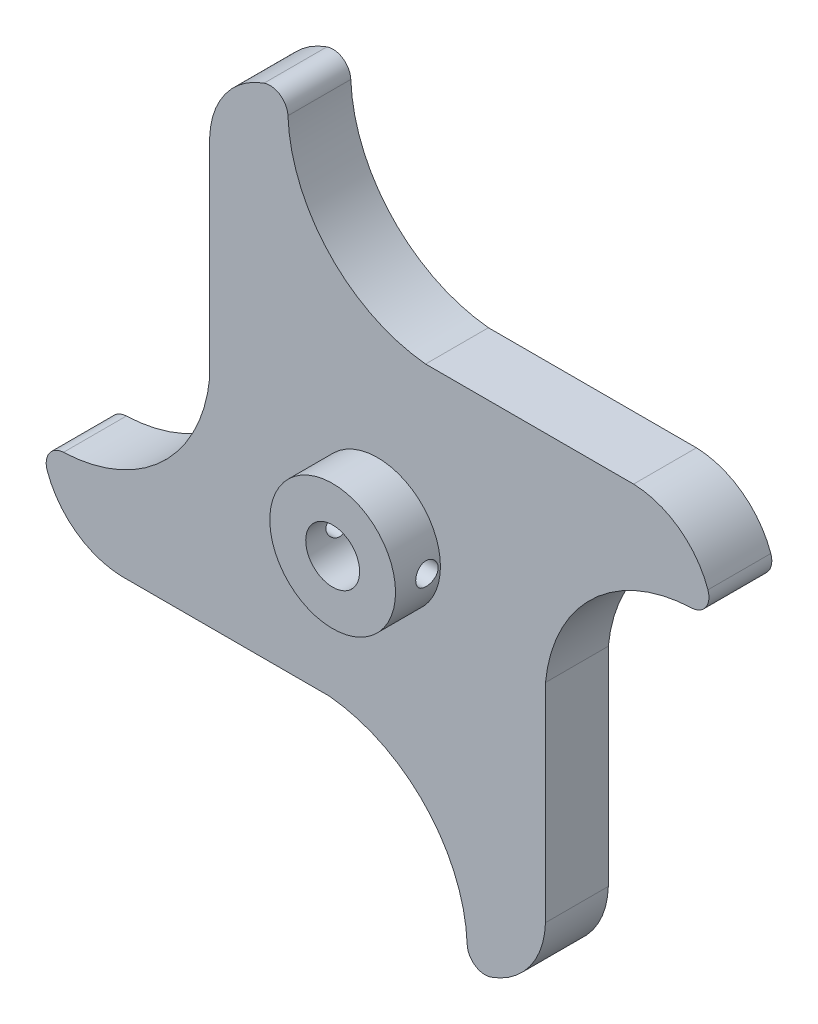
from build123d import *
from build123d.topology import SkipClean

# Parameters (mm, degrees)
SKETCH_1_R               = 3
EXTRUDE_1_DEPTH          = 7
SKETCH_5_R               = 7
EXTRUDE_2_DEPTH          = 4
EXTRUDE_START            = 7
EXTRUDE_3_DEPTH          = 7
CUT_EXTRUDE_5_DEPTH      = 8
CUT_EXTRUDE_5_DEPTH_BACK = 15
SKETCH_12_R              = 6
SKETCH_12_R_2            = 3
EXTRUDE_4_DEPTH          = 1
SKETCH_13_R              = 82.694540834
CUT_EXTRUDE_13_DEPTH     = 10
FILLET_1_R               = 2
FILLET_2_R               = 2
EXTRUDE_5_DEPTH          = 7
CUT_EXTRUDE_14_DEPTH     = 10
FILLET_3_R               = 3
FILLET_4_R               = 1
EXTRUDE_START_2          = -7
EXTRUDE_6_DEPTH          = 7
SKETCH_18_R              = 47.238796546
CUT_EXTRUDE_15_DEPTH     = 10
FILLET_5_R               = 2
SKETCH_22_R              = 7
SKETCH_22_R_2            = 6
EXTRUDE_8_DEPTH          = 1


with BuildPart() as part:
    # 草图1 → 凸台-拉伸1 (new body)
    with BuildSketch(Plane.XY):
        with BuildLine():
            ThreePointArc((32.8, 22.894540834), (36.610888994, 26.155959788), (40.879786515, 28.789634497))
            ThreePointArc((40.879786515, 28.789634497), (35.355339059, 35.355339059), (28.789634497, 40.879786515))
            ThreePointArc((28.789634497, 40.879786515), (26.155959788, 36.610888994), (22.894540834, 32.8))
            ThreePointArc((22.894540834, 32.8), (0, 23.316770682), (-22.894540834, 32.8))
            ThreePointArc((-22.894540834, 32.8), (-26.155959788, 36.610888994), (-28.789634497, 40.879786515))
            ThreePointArc((-28.789634497, 40.879786515), (-35.355339059, 35.355339059), (-40.879786515, 28.789634497))
            ThreePointArc((-40.879786515, 28.789634497), (-36.610888994, 26.155959788), (-32.8, 22.894540834))
            ThreePointArc((-32.8, 22.894540834), (-23.316770682, 0), (-32.8, -22.894540834))
            ThreePointArc((-32.8, -22.894540834), (-36.610888994, -26.155959788), (-40.879786515, -28.789634497))
            ThreePointArc((-40.879786515, -28.789634497), (-35.355339059, -35.355339059), (-28.789634497, -40.879786515))
            ThreePointArc((-28.789634497, -40.879786515), (-26.155959788, -36.610888994), (-22.894540834, -32.8))
            ThreePointArc((-22.894540834, -32.8), (0, -23.316770682), (22.894540834, -32.8))
            ThreePointArc((22.894540834, -32.8), (26.155959788, -36.610888994), (28.789634497, -40.879786515))
            ThreePointArc((28.789634497, -40.879786515), (35.355339059, -35.355339059), (40.879786515, -28.789634497))
            ThreePointArc((40.879786515, -28.789634497), (36.610888994, -26.155959788), (32.8, -22.894540834))
            ThreePointArc((32.8, -22.894540834), (23.316770682, 0), (32.8, 22.894540834))
        make_face()
        Circle(SKETCH_1_R, mode=Mode.SUBTRACT)
    extrude(amount=EXTRUDE_1_DEPTH)

    # 草图5 → 凸台-拉伸2 (add)
    with BuildSketch(Plane.XY.offset(7)):
        Circle(SKETCH_5_R)
        with BuildLine():
            Line((-1.658312395, 2.5), (1.658312395, 2.5))
            ThreePointArc((1.658312395, 2.5), (0, -3), (-1.658312395, 2.5))
        make_face(mode=Mode.SUBTRACT)
    extrude(amount=EXTRUDE_2_DEPTH)

    # 草图10 → 凸台-拉伸3 (add)
    with BuildSketch(Plane(origin=(0, 0, 7), x_dir=(-1, 0, 0), z_dir=(0, 0, -1)).offset(EXTRUDE_START)):
        with BuildLine():
            Line((-1.658312395, 2.5), (1.658312395, 2.5))
            ThreePointArc((1.658312395, 2.5), (0, 3), (-1.658312395, 2.5))
        make_face()
    extrude(amount=-EXTRUDE_3_DEPTH)

    # 草图11 → 切除-拉伸5 (cut, two sides: drawn at the far end of the back side and taken through both)
    with BuildSketch(Plane(origin=(0, 0, 0), x_dir=(0, 0, -1), z_dir=(1, 0, 0)).offset(-CUT_EXTRUDE_5_DEPTH_BACK)):
        with BuildLine():
            ThreePointArc((-9.75, 0), (-8.5, -1.25), (-7.25, 0))
            Line((-7.25, 0), (-9.75, 0))
        make_face()
        with BuildLine():
            Line((-9.75, 0), (-7.25, 0))
            ThreePointArc((-7.25, 0), (-8.5, 1.25), (-9.75, 0))
        make_face()
    extrude(amount=CUT_EXTRUDE_5_DEPTH + CUT_EXTRUDE_5_DEPTH_BACK, mode=Mode.SUBTRACT)

    # 草图12 → 凸台-拉伸4 (add)
    with BuildSketch(Plane.XY.offset(11)):
        Circle(SKETCH_12_R)
        with Locations(Location((0, 0, 0), (0, 0, 123.557309762))):
            Circle(SKETCH_12_R_2, mode=Mode.SUBTRACT)
    extrude(amount=EXTRUDE_4_DEPTH)

    # 草图13 → 切除-拉伸13 (cut)
    with BuildSketch(Plane(origin=(0, 0, 0), x_dir=(-1, 0, 0), z_dir=(0, 0, -1))):
        Circle(SKETCH_13_R)
        with BuildLine():
            ThreePointArc((-25.243635923, 31.028355505), (0, 18.694540834), (25.243635923, 31.028355505))
            ThreePointArc((25.243635923, 31.028355505), (28.284271247, 28.284271247), (31.028355505, 25.243635923))
            ThreePointArc((31.028355505, 25.243635923), (18.694540834, 0), (31.028355505, -25.243635923))
            ThreePointArc((31.028355505, -25.243635923), (28.284271247, -28.284271247), (25.243635923, -31.028355505))
            ThreePointArc((25.243635923, -31.028355505), (0, -18.694540834), (-25.243635923, -31.028355505))
            ThreePointArc((-25.243635923, -31.028355505), (-28.284271247, -28.284271247), (-31.028355505, -25.243635923))
            ThreePointArc((-31.028355505, -25.243635923), (-18.694540834, 0), (-31.028355505, 25.243635923))
            ThreePointArc((-31.028355505, 25.243635923), (-28.284271247, 28.284271247), (-25.243635923, 31.028355505))
        make_face(mode=Mode.SUBTRACT)
    extrude(amount=-CUT_EXTRUDE_13_DEPTH, mode=Mode.SUBTRACT)

    # 圆角1
    fillet_1_edges = [part.edges().sort_by_distance(p)[0] for p in [
        (25.243635923, 31.028355505, 3.5),
        (-31.028355505, 25.243635923, 3.5),
        (-31.028355505, -25.243635923, 3.5),
        (31.028355505, -25.243635923, 3.5),
    ]]
    fillet(fillet_1_edges, radius=FILLET_1_R)

    # 圆角2
    fillet_2_edges = [part.edges().sort_by_distance(p)[0] for p in [
        (-25.243635923, 31.028355505, 3.5),
        (-25.243635923, -31.028355505, 3.5),
        (25.243635923, -31.028355505, 3.5),
        (31.028355505, 25.243635923, 3.5),
    ]]
    fillet(fillet_2_edges, radius=FILLET_2_R)

    # 草图14 → 凸台-拉伸5 (add)
    # profile 1 of 5: a face of its own
    with SkipClean():  # the faces are left unmerged after this step: merging them gives an invalid solid
        with BuildSketch(Plane(origin=(0, 0, 0), x_dir=(-1, 0, 0), z_dir=(0, 0, -1))):
            with BuildLine():
                ThreePointArc((18.694540834, 24.723130726), (9.821274778, 20.238957409), (0, 18.694540834))
                Line((0, 18.694540834), (-24.723130726, 18.694540834))
                ThreePointArc((-24.723130726, 18.694540834), (-20.238957409, 9.821274778), (-18.694540834, 0))
                Line((-18.694540834, 0), (-18.694540834, -24.723130726))
                ThreePointArc((-18.694540834, -24.723130726), (-9.821274778, -20.238957409), (0, -18.694540834))
                Line((0, -18.694540834), (24.723130726, -18.694540834))
                ThreePointArc((24.723130726, -18.694540834), (20.238957409, -9.821274778), (18.694540834, 0))
                Line((18.694540834, 0), (18.694540834, 24.723130726))
            make_face()
            with BuildLine():
                Line((-1.658312395, 2.5), (1.658312395, 2.5))
                ThreePointArc((1.658312395, 2.5), (0, -3), (-1.658312395, 2.5))
            make_face(mode=Mode.SUBTRACT)
        # profile 2 of 5: a face of its own
        with BuildSketch(Plane(origin=(0, 0, 0), x_dir=(-1, 0, 0), z_dir=(0, 0, -1))):
            with BuildLine():
                ThreePointArc((-18.694540834, 0), (-20.238957409, 9.821274778), (-24.723130726, 18.694540834))
                Line((-24.723130726, 18.694540834), (-34.095635208, 18.694540834))
                Line((-34.095635208, 18.694540834), (-34.095635208, 16.908162968))
                Line((-34.095635208, 16.908162968), (-34.095635208, 13.801737807))
                ThreePointArc((-34.095635208, 13.801737807), (-23.536654529, 10.090539986), (-18.694540834, 0))
            make_face()
        # profile 3 of 5: a face of its own
        with BuildSketch(Plane(origin=(0, 0, 0), x_dir=(-1, 0, 0), z_dir=(0, 0, -1))):
            with BuildLine():
                ThreePointArc((13.801737807, 34.095635208), (10.090539986, 23.536654529), (0, 18.694540834))
                ThreePointArc((0, 18.694540834), (9.821274778, 20.238957409), (18.694540834, 24.723130726))
                Line((18.694540834, 24.723130726), (18.694540834, 34.095635208))
                Line((18.694540834, 34.095635208), (16.908162968, 34.095635208))
                Line((16.908162968, 34.095635208), (13.801737807, 34.095635208))
            make_face()
        # profile 4 of 5: a face of its own
        with BuildSketch(Plane(origin=(0, 0, 0), x_dir=(-1, 0, 0), z_dir=(0, 0, -1))):
            with BuildLine():
                ThreePointArc((34.095635208, -13.801737807), (23.536654529, -10.090539986), (18.694540834, 0))
                ThreePointArc((18.694540834, 0), (20.238957409, -9.821274778), (24.723130726, -18.694540834))
                Line((24.723130726, -18.694540834), (34.095635208, -18.694540834))
                Line((34.095635208, -18.694540834), (34.095635208, -16.908162968))
                Line((34.095635208, -16.908162968), (34.095635208, -13.801737807))
            make_face()
        # profile 5 of 5: a face of its own
        with BuildSketch(Plane(origin=(0, 0, 0), x_dir=(-1, 0, 0), z_dir=(0, 0, -1))):
            with BuildLine():
                ThreePointArc((0, -18.694540834), (-9.821274778, -20.238957409), (-18.694540834, -24.723130726))
                Line((-18.694540834, -24.723130726), (-18.694540834, -34.095635208))
                Line((-18.694540834, -34.095635208), (-16.908162968, -34.095635208))
                Line((-16.908162968, -34.095635208), (-13.801737807, -34.095635208))
                ThreePointArc((-13.801737807, -34.095635208), (-10.090539986, -23.536654529), (0, -18.694540834))
            make_face()
        extrude(amount=-EXTRUDE_5_DEPTH)

    # 草图15 → 切除-拉伸14 (cut)
    with SkipClean():  # the faces are left unmerged after this step: merging them gives an invalid solid
        with BuildSketch(Plane(origin=(0, 0, 0), x_dir=(-1, 0, 0), z_dir=(0, 0, -1))):
            with BuildLine():
                Line((-24.723130726, 18.694540834), (-33.334723843, 25.692106251))
                Line((-33.334723843, 25.692106251), (-12.530174443, 42.497606237))
                Line((-12.530174443, 42.497606237), (0, 18.694540834))
                ThreePointArc((0, 18.694540834), (-13.155803158, 21.523924741), (-23.985180208, 29.51173813))
                ThreePointArc((-23.985180208, 29.51173813), (-25.372019669, 30.184661343), (-26.825530496, 29.671382064))
                ThreePointArc((-26.825530496, 29.671382064), (-28.284271247, 28.284271247), (-29.671382064, 26.825530496))
                ThreePointArc((-29.671382064, 26.825530496), (-30.184661343, 25.372019669), (-29.51173813, 23.985180208))
                ThreePointArc((-29.51173813, 23.985180208), (-26.969497889, 21.473759272), (-24.723130726, 18.694540834))
            make_face()
            with BuildLine():
                Line((-24.723130726, 18.694540834), (0, 18.694540834))
                ThreePointArc((0, 18.694540834), (-13.155803158, 21.523924741), (-23.985180208, 29.51173813))
                ThreePointArc((-23.985180208, 29.51173813), (-25.372019669, 30.184661343), (-26.825530496, 29.671382064))
                ThreePointArc((-26.825530496, 29.671382064), (-28.284271247, 28.284271247), (-29.671382064, 26.825530496))
                ThreePointArc((-29.671382064, 26.825530496), (-30.184661343, 25.372019669), (-29.51173813, 23.985180208))
                ThreePointArc((-29.51173813, 23.985180208), (-26.969497889, 21.473759272), (-24.723130726, 18.694540834))
            make_face()
            with BuildLine():
                Line((18.694540834, 0), (18.694540834, 24.723130726))
                ThreePointArc((18.694540834, 24.723130726), (21.473759272, 26.969497889), (23.985180208, 29.51173813))
                ThreePointArc((23.985180208, 29.51173813), (25.372019669, 30.184661343), (26.825530496, 29.671382064))
                ThreePointArc((26.825530496, 29.671382064), (28.284271247, 28.284271247), (29.671382064, 26.825530496))
                ThreePointArc((29.671382064, 26.825530496), (30.184661343, 25.372019669), (29.51173813, 23.985180208))
                ThreePointArc((29.51173813, 23.985180208), (21.523924741, 13.155803158), (18.694540834, 0))
            make_face()
            with BuildLine():
                Line((18.694540834, 24.723130726), (25.692106251, 33.334723843))
                Line((25.692106251, 33.334723843), (42.497606237, 12.530174443))
                Line((42.497606237, 12.530174443), (18.694540834, 0))
                ThreePointArc((18.694540834, 0), (21.523924741, 13.155803158), (29.51173813, 23.985180208))
                ThreePointArc((29.51173813, 23.985180208), (30.184661343, 25.372019669), (29.671382064, 26.825530496))
                ThreePointArc((29.671382064, 26.825530496), (28.284271247, 28.284271247), (26.825530496, 29.671382064))
                ThreePointArc((26.825530496, 29.671382064), (25.372019669, 30.184661343), (23.985180208, 29.51173813))
                ThreePointArc((23.985180208, 29.51173813), (21.473759272, 26.969497889), (18.694540834, 24.723130726))
            make_face()
            with BuildLine():
                ThreePointArc((29.51173813, -23.985180208), (26.969497889, -21.473759272), (24.723130726, -18.694540834))
                Line((24.723130726, -18.694540834), (0.927061706, -18.707972456))
                ThreePointArc((0.927061706, -18.707972456), (13.577013202, -21.717572178), (23.985180208, -29.51173813))
                ThreePointArc((23.985180208, -29.51173813), (25.372019669, -30.184661343), (26.825530496, -29.671382064))
                ThreePointArc((26.825530496, -29.671382064), (28.284271247, -28.284271247), (29.671382064, -26.825530496))
                ThreePointArc((29.671382064, -26.825530496), (30.184661343, -25.372019669), (29.51173813, -23.985180208))
            make_face()
            with BuildLine():
                Line((24.723130726, -18.694540834), (33.334723843, -25.692106251))
                Line((33.334723843, -25.692106251), (12.530174443, -42.497606237))
                Line((12.530174443, -42.497606237), (0, -18.694540834))
                ThreePointArc((0, -18.694540834), (13.155803158, -21.523924741), (23.985180208, -29.51173813))
                ThreePointArc((23.985180208, -29.51173813), (25.372019669, -30.184661343), (26.825530496, -29.671382064))
                ThreePointArc((26.825530496, -29.671382064), (28.284271247, -28.284271247), (29.671382064, -26.825530496))
                ThreePointArc((29.671382064, -26.825530496), (30.184661343, -25.372019669), (29.51173813, -23.985180208))
                ThreePointArc((29.51173813, -23.985180208), (26.969497889, -21.473759272), (24.723130726, -18.694540834))
            make_face()
            with BuildLine():
                Line((-42.497606237, -12.530174443), (-18.694540834, 0))
                ThreePointArc((-18.694540834, 0), (-21.523924741, -13.155803158), (-29.51173813, -23.985180208))
                ThreePointArc((-29.51173813, -23.985180208), (-30.184661343, -25.372019669), (-29.671382064, -26.825530496))
                ThreePointArc((-29.671382064, -26.825530496), (-28.284271247, -28.284271247), (-26.825530496, -29.671382064))
                ThreePointArc((-26.825530496, -29.671382064), (-25.372019669, -30.184661343), (-23.985180208, -29.51173813))
                ThreePointArc((-23.985180208, -29.51173813), (-21.473759272, -26.969497889), (-18.694540834, -24.723130726))
                Line((-18.694540834, -24.723130726), (-25.692106251, -33.334723843))
                Line((-25.692106251, -33.334723843), (-42.497606237, -12.530174443))
            make_face()
            with BuildLine():
                Line((-18.694540834, -24.723130726), (-18.694540834, 0))
                ThreePointArc((-18.694540834, 0), (-21.523924741, -13.155803158), (-29.51173813, -23.985180208))
                ThreePointArc((-29.51173813, -23.985180208), (-30.184661343, -25.372019669), (-29.671382064, -26.825530496))
                ThreePointArc((-29.671382064, -26.825530496), (-28.284271247, -28.284271247), (-26.825530496, -29.671382064))
                ThreePointArc((-26.825530496, -29.671382064), (-25.372019669, -30.184661343), (-23.985180208, -29.51173813))
                ThreePointArc((-23.985180208, -29.51173813), (-21.473759272, -26.969497889), (-18.694540834, -24.723130726))
            make_face()
        extrude(amount=-CUT_EXTRUDE_14_DEPTH, mode=Mode.SUBTRACT)

    # 圆角3
    fillet_3_edges = [part.edges().sort_by_distance(p)[0] for p in [
        (34.095635208, 18.694540834, 3.5),
        (-18.694540834, 34.095635208, 3.5),
        (-34.095635208, -18.694540834, 3.5),
        (18.694540834, -34.095635208, 3.5),
    ]]
    fillet(fillet_3_edges, radius=FILLET_3_R)

    # 圆角4
    fillet_4_edges = [part.edges().sort_by_distance(p)[0] for p in [
        (-13.801737807, 34.095635208, 3.5),
        (-34.095635208, -13.801737807, 3.5),
        (13.801737807, -34.095635208, 3.5),
        (34.095635208, 13.801737807, 3.5),
    ]]
    fillet(fillet_4_edges, radius=FILLET_4_R)

    # 草图16 → 凸台-拉伸6 (add)
    with SkipClean():  # the faces are left unmerged after this step: merging them gives an invalid solid
        with BuildSketch(Plane(origin=(0, 0, 0), x_dir=(-1, 0, 0), z_dir=(0, 0, -1)).offset(EXTRUDE_START_2)):
            with BuildLine():
                ThreePointArc((9.910873566, 37.290487321), (6.133427391, 24.832564637), (-5.346712023, 18.694540834))
                Line((-5.346712023, 18.694540834), (0, 18.694540834))
                ThreePointArc((0, 18.694540834), (9.754847949, 23.174553207), (13.822417362, 33.108457194))
                ThreePointArc((13.822417362, 33.108457194), (14.119776258, 33.807260807), (14.822335157, 34.095635208))
                Line((14.822335157, 34.095635208), (15.694540834, 34.095635208))
                ThreePointArc((15.694540834, 34.095635208), (16.201960761, 34.052411326), (16.694758916, 33.923985219))
                ThreePointArc((16.694758916, 33.923985219), (13.671949052, 36.351080947), (9.910873566, 37.290487321))
            make_face()
            with BuildLine():
                ThreePointArc((-37.290487321, 9.910873566), (-24.832564637, 6.133427391), (-18.694540834, -5.346712023))
                Line((-18.694540834, -5.346712023), (-18.694540834, 0))
                ThreePointArc((-18.694540834, 0), (-23.174553207, 9.754847949), (-33.108457194, 13.822417362))
                ThreePointArc((-33.108457194, 13.822417362), (-33.807260807, 14.119776258), (-34.095635208, 14.822335157))
                Line((-34.095635208, 14.822335157), (-34.095635208, 15.694540834))
                ThreePointArc((-34.095635208, 15.694540834), (-34.052411326, 16.201960761), (-33.923985219, 16.694758916))
                ThreePointArc((-33.923985219, 16.694758916), (-36.351080947, 13.671949052), (-37.290487321, 9.910873566))
            make_face()
            with BuildLine():
                ThreePointArc((-9.910873566, -37.290487321), (-6.167788996, -24.874581099), (5.238714674, -18.705538756))
                Line((5.238714674, -18.705538756), (0.927061706, -18.707972456))
                ThreePointArc((0.927061706, -18.707972456), (0.463579501, -18.697898916), (0, -18.694540834))
                ThreePointArc((0, -18.694540834), (-9.754847949, -23.174553207), (-13.822417362, -33.108457194))
                ThreePointArc((-13.822417362, -33.108457194), (-14.119776258, -33.807260807), (-14.822335157, -34.095635208))
                Line((-14.822335157, -34.095635208), (-15.694540834, -34.095635208))
                ThreePointArc((-15.694540834, -34.095635208), (-16.201960761, -34.052411326), (-16.694758916, -33.923985219))
                ThreePointArc((-16.694758916, -33.923985219), (-13.671949052, -36.351080947), (-9.910873566, -37.290487321))
            make_face()
            with BuildLine():
                ThreePointArc((37.290487321, -9.910873566), (24.832564637, -6.133427391), (18.694540834, 5.346712023))
                Line((18.694540834, 5.346712023), (18.694540834, 0))
                ThreePointArc((18.694540834, 0), (23.174553207, -9.754847949), (33.108457194, -13.822417362))
                ThreePointArc((33.108457194, -13.822417362), (33.807260807, -14.119776258), (34.095635208, -14.822335157))
                Line((34.095635208, -14.822335157), (34.095635208, -15.694540834))
                ThreePointArc((34.095635208, -15.694540834), (34.052411326, -16.201960761), (33.923985219, -16.694758916))
                ThreePointArc((33.923985219, -16.694758916), (36.351080947, -13.671949052), (37.290487321, -9.910873566))
            make_face()
        extrude(amount=EXTRUDE_6_DEPTH)

    # 草图18 → 切除-拉伸15 (cut)
    with SkipClean():  # the faces are left unmerged after this step: merging them gives an invalid solid
        with BuildSketch(Plane.XY.offset(7)):
            Circle(SKETCH_18_R)
            with BuildLine():
                Line((5.346712023, 18.694540834), (27.984188654, 18.694540834))
                ThreePointArc((27.984188654, 18.694540834), (34.456495042, 16.230104762), (37.290487321, 9.910873566))
                ThreePointArc((37.290487321, 9.910873566), (24.832564637, 6.133427391), (18.694540834, -5.346712023))
                Line((18.694540834, -5.346712023), (18.694540834, -27.984188654))
                ThreePointArc((18.694540834, -27.984188654), (16.230104762, -34.456495042), (9.910873566, -37.290487321))
                ThreePointArc((9.910873566, -37.290487321), (6.133427391, -24.832564637), (-5.346712023, -18.694540834))
                Line((-5.346712023, -18.694540834), (-27.984188654, -18.694540834))
                ThreePointArc((-27.984188654, -18.694540834), (-34.456495042, -16.230104762), (-37.290487321, -9.910873566))
                ThreePointArc((-37.290487321, -9.910873566), (-24.832564637, -6.133427391), (-18.694540834, 5.346712023))
                Line((-18.694540834, 5.346712023), (-18.694540834, 27.984188654))
                ThreePointArc((-18.694540834, 27.984188654), (-16.230104762, 34.456495042), (-9.910873566, 37.290487321))
                ThreePointArc((-9.910873566, 37.290487321), (-6.133427391, 24.832564637), (5.346712023, 18.694540834))
            make_face(mode=Mode.SUBTRACT)
        extrude(amount=-CUT_EXTRUDE_15_DEPTH, mode=Mode.SUBTRACT)

    # 圆角5
    fillet_5_edges = [part.edges().sort_by_distance(p)[0] for p in [
        (-9.910873566, 37.290487321, 3.5),
        (37.290487321, 9.910873566, 3.5),
        (9.910873566, -37.290487321, 3.5),
        (-37.290487321, -9.910873566, 3.5),
    ]]
    fillet(fillet_5_edges, radius=FILLET_5_R)

    # 草图22 → 凸台-拉伸8 (add)
    with SkipClean():  # the faces are left unmerged after this step: merging them gives an invalid solid
        with BuildSketch(Plane.XY.offset(11)):
            Circle(SKETCH_22_R)
            Circle(SKETCH_22_R_2, mode=Mode.SUBTRACT)
        extrude(amount=EXTRUDE_8_DEPTH)


solid = part.part
